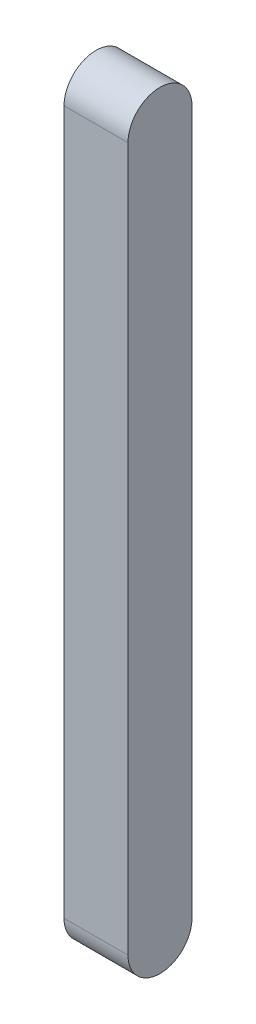
from build123d import *

# Parameters (mm, degrees)
SKETCH_1_R      = 5
SKETCH_1_W      = 10
SKETCH_1_H      = 110
EXTRUDE_1_DEPTH = 10


with BuildPart() as part:
    # 草图1 → 凸台-拉伸1 (new body)
    with BuildSketch(Plane(origin=(0, 0, 0), x_dir=(0, 0, -1), z_dir=(1, 0, 0))):
        with Locations((0, 55)):
            Circle(SKETCH_1_R)
        with Locations((0, -55)):
            Circle(SKETCH_1_R)
        Rectangle(SKETCH_1_W, SKETCH_1_H)
    extrude(amount=EXTRUDE_1_DEPTH)


solid = part.part
